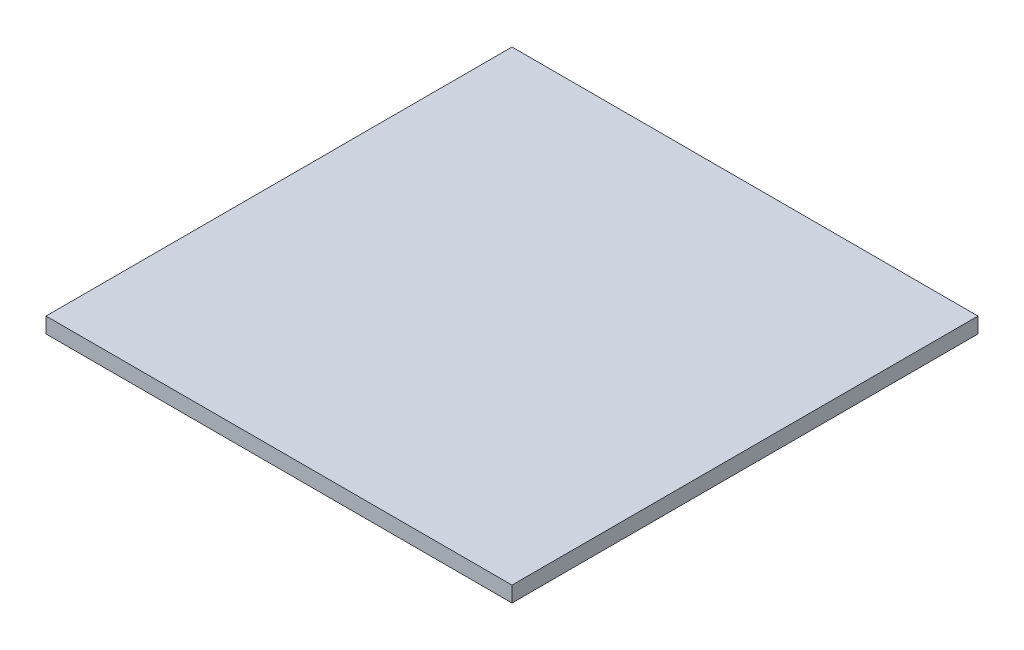
from build123d import *

# Parameters (mm, degrees)
SKETCH1_W           = 60
SKETCH1_H           = 60
BOSS_EXTRUDE1_DEPTH = 1


with BuildPart() as part:
    # Sketch1 → Boss-Extrude1 (new, symmetric)
    with BuildSketch(Plane(origin=(0, 0, 0), x_dir=(1, 0, 0), z_dir=(0, 1, 0))):
        Rectangle(SKETCH1_W, SKETCH1_H)
    extrude(amount=BOSS_EXTRUDE1_DEPTH, both=True)


solid = part.part
